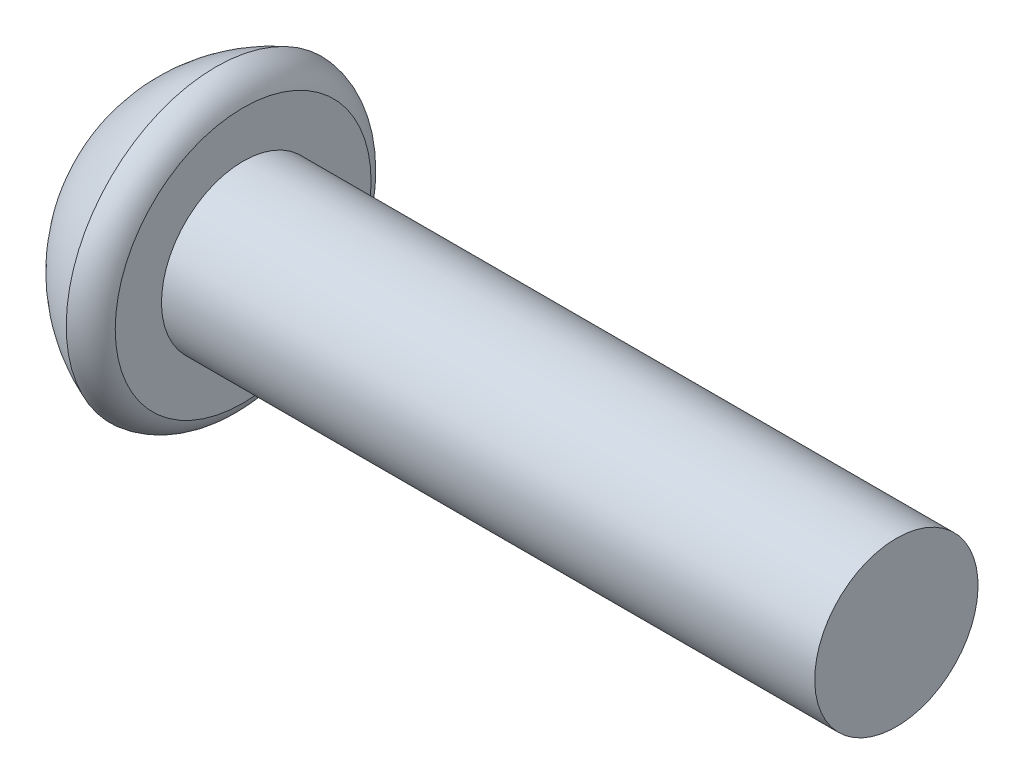
from build123d import *

# Parameters (mm, degrees)
CUT_EXTRUDE1_DEPTH = 1.5


with BuildPart() as part:
    # Sketch1 → Revolve1 (revolve)
    with BuildSketch(Plane.XY):
        with BuildLine():
            Line((0, 0), (12, 0))
            Line((12, 0), (12, -1.5))
            Line((12, -1.5), (-2, -1.5))
            Line((-2, -1.5), (-2, 0))
            ThreePointArc((-2, 0), (-1.356037029, 0.752244435), (-0.5, 1.25))
            ThreePointArc((-0.5, 1.25), (-0.192181086, 1.122273642), (0, 0.85))
            Line((0, 0.85), (0, 0))
        make_face()
    revolve(axis=Axis((12, -1.5, 0), (-1, 0, 0)))

    # Sketch2 → Cut-Extrude1 (cut)
    with BuildSketch(Plane.ZY.offset(2)):
        Polygon((0, -0.229829408), (-1.1, -0.864914704), (-1.1, -2.135085296), (0, -2.770170592), (1.1, -2.135085296), (1.1, -0.864914704), align=None)
    extrude(amount=-CUT_EXTRUDE1_DEPTH, mode=Mode.SUBTRACT)


solid = part.part
